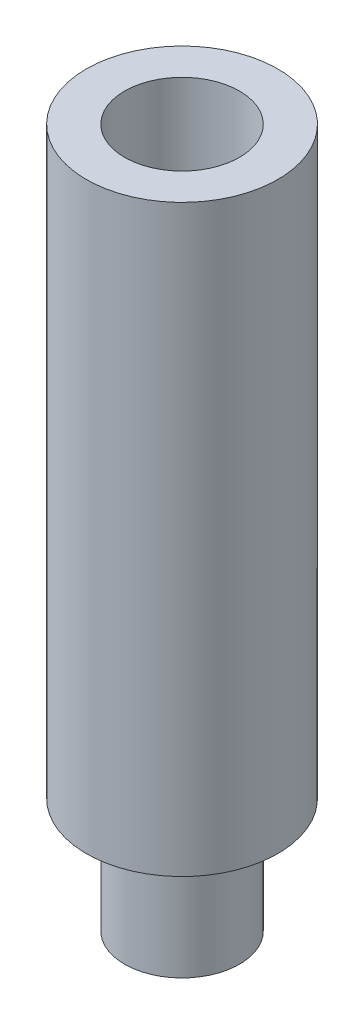
from build123d import *


with BuildPart() as part:
    # Sketch1 → Revolve1 (revolve)
    with BuildSketch(Plane.XY):
        Polygon((-2.5, 18.24), (-2.5, 3), (-1.5, 3), (-1.5, 0), (0, 0), (0, 13.24), (-1.5, 13.24), (-1.5, 18.24), align=None)
    revolve(axis=Axis((0, 38.383486715, 0), (0, -1, 0)))


solid = part.part
